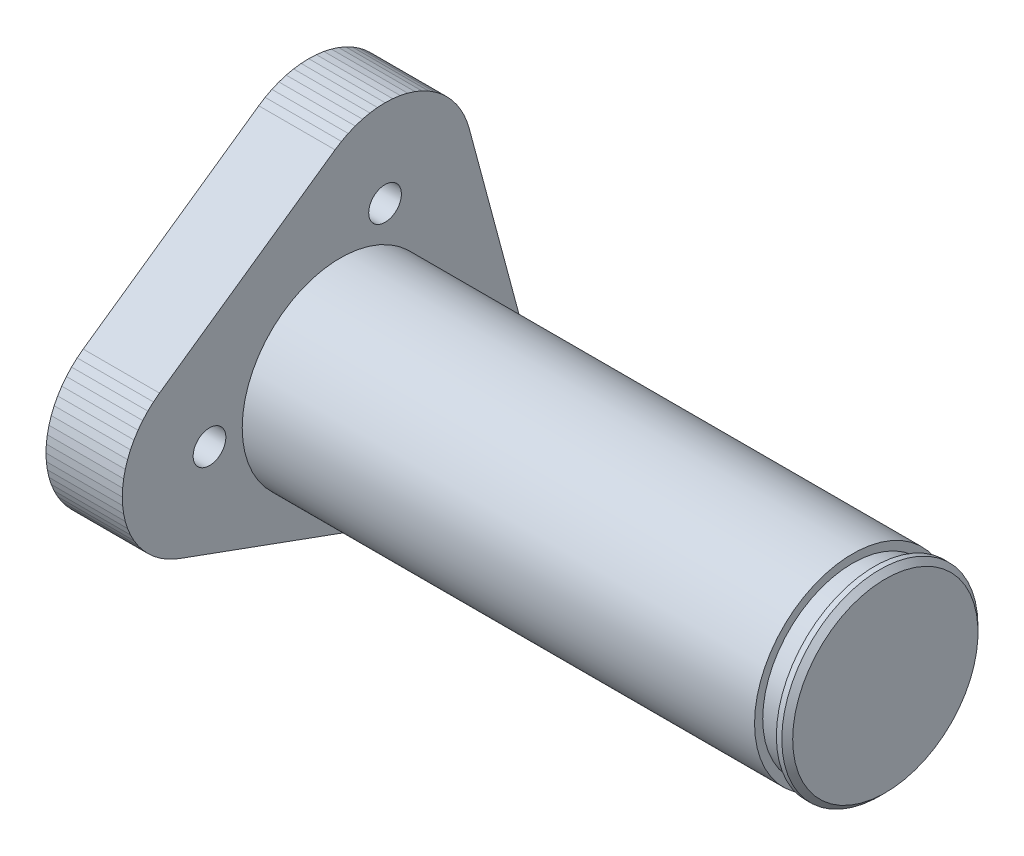
from build123d import *

# Parameters (mm, degrees)
F_02_HEAD_DEPTH        = 7
SKETCH_3_R             = 1.5
F_03_SCREW_HOLES_DEPTH = 64.408013115
SKETCH_4_R             = 2.75
F_04_CBORE_DEPTH       = 3
SKETCH_5_R             = 3.4
F_05_M8_TAP_DEPTH      = 24


with BuildPart() as part:
    # 草图1 → 旋转1 (revolve)
    with BuildSketch(Plane.XY, mode=Mode.PRIVATE) as revolve_1_sk:
        Polygon((7, 0), (7, 9), (54, 9), (54, 8.25), (56, 8.25), (56, 9), (56.5, 9), (57, 8.5), (57, 0), align=None)
    revolve(revolve_1_sk.sketch.rotate(Axis((2, 0, 0), (1, 0, 0)), 90), axis=Axis((2, 0, 0), (1, 0, 0)))

    # 草图2 → 02_HEAD (add)
    with BuildSketch(Plane(origin=(0, 0, 0), x_dir=(0, 0, -1), z_dir=(1, 0, 0))):
        Polygon((-20, 0), (-19.96956, -0.69725), (-19.87846, -1.38919), (-19.72741, -2.07055), (-19.51754, -2.73616), (-19.25046, -3.38095), (-18.9282, -4), (-18.55322, -4.58861), (-18.12836, -5.1423), (-17.65685, -5.65685), (-17.1423, -6.12836), (-16.58861, -6.55322), (-16, -6.9282), (-15.38095, -7.25046), (-14.73616, -7.51754), (6.45637, -15.23099), (7.12198, -15.44086), (7.80335, -15.59191), (8.49529, -15.68301), (9.19253, -15.71345), (9.88978, -15.68301), (10.58172, -15.59191), (11.26309, -15.44086), (11.92869, -15.23099), (12.57348, -14.96391), (13.19253, -14.64165), (13.78114, -14.26667), (14.33483, -13.84181), (14.84939, -13.37031), (15.32089, -12.85575), (15.74575, -12.30206), (16.12074, -11.71345), (16.443, -11.0944), (16.71007, -10.44961), (16.91994, -9.784), (17.071, -9.10264), (17.16209, -8.4107), (17.19253, -7.71345), (17.16209, -7.01621), (17.071, -6.32427), (16.91994, -5.6429), (11.83165, 13.34686), (11.62178, 14.01247), (11.3547, 14.65726), (11.03244, 15.27631), (10.65746, 15.86492), (10.2326, 16.41861), (9.7611, 16.93317), (9.24654, 17.40467), (8.69285, 17.82953), (8.10424, 18.20451), (7.48519, 18.52677), (6.8404, 18.79385), (6.17479, 19.00372), (5.49343, 19.15477), (4.80149, 19.24587), (4.10424, 19.27631), (3.407, 19.24587), (2.71506, 19.15477), (2.03369, 19.00372), (1.36808, 18.79385), (0.7233, 18.52677), (0.10424, 18.20451), (-0.48437, 17.82953), (-16.58861, 6.55322), (-17.1423, 6.12836), (-17.65685, 5.65685), (-18.12836, 5.1423), (-18.55322, 4.58861), (-18.9282, 4), (-19.25046, 3.38095), (-19.51754, 2.73616), (-19.72741, 2.07055), (-19.87846, 1.38919), (-19.96956, 0.69725), align=None)
    extrude(amount=F_02_HEAD_DEPTH)

    # 草图3 → 03_SCREW_HOLES (cut, through all)
    with BuildSketch(Plane(origin=(0, 0, 0), x_dir=(0, 0, -1), z_dir=(1, 0, 0))):
        with Locations(Location((-12, 0, 0), (0, 0, 180))):
            Circle(SKETCH_3_R)
        with Locations(Location((4.10424172, 11.276311449, 0), (0, 0, 180))):
            Circle(SKETCH_3_R)
        with Locations(Location((9.192533317, -7.713451316, 0), (0, 0, 180))):
            Circle(SKETCH_3_R)
    extrude(amount=F_03_SCREW_HOLES_DEPTH, mode=Mode.SUBTRACT)

    # 草图4 → 04_CBORE (cut)
    with BuildSketch(Plane(origin=(0, 0, 0), x_dir=(0, 0, -1), z_dir=(1, 0, 0))):
        with Locations((-12, 0)):
            Circle(SKETCH_4_R)
        with Locations((4.10424172, 11.276311449)):
            Circle(SKETCH_4_R)
        with Locations((9.192533317, -7.713451316)):
            Circle(SKETCH_4_R)
    extrude(amount=F_04_CBORE_DEPTH, mode=Mode.SUBTRACT)

    # 草图5 → 05_M8_TAP (cut)
    with BuildSketch(Plane(origin=(0, 0, 0), x_dir=(0, 0, -1), z_dir=(1, 0, 0))):
        Circle(SKETCH_5_R)
    extrude(amount=F_05_M8_TAP_DEPTH, mode=Mode.SUBTRACT)


solid = part.part
